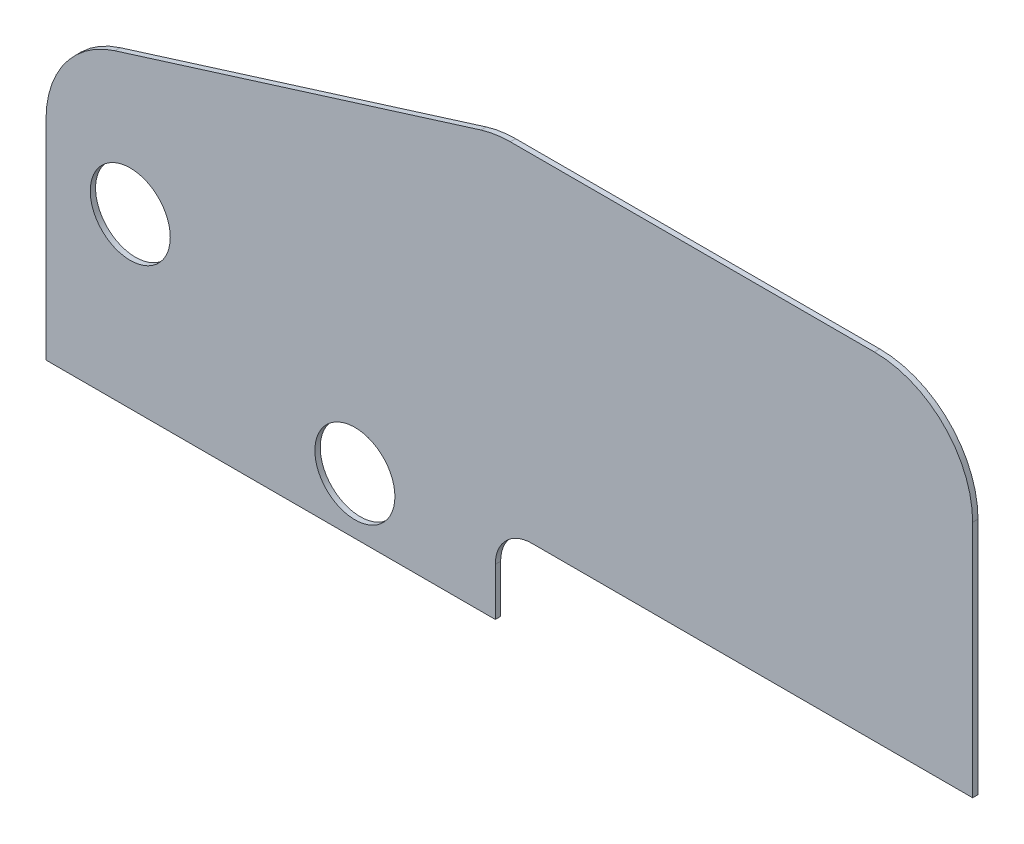
from build123d import *

# Parameters (mm, degrees)
RESSALTO_EXTRUS_O1_DEPTH = 1.9
ESBO_O2_R                = 14.25
CORTE_EXTRUS_O1_DEPTH    = 1.9
FILETE1_R                = 13
FILETE2_R                = 35


with BuildPart() as part:
    # Esboço1 → Ressalto-extrusão1 (new body)
    with BuildSketch(Plane.XY):
        Polygon((-160, 70), (0, 120), (170, 120), (170, 0), (0, 0), (0, -30), (-160, -30), align=None)
    extrude(amount=RESSALTO_EXTRUS_O1_DEPTH)

    # Esboço2 → Corte-extrusão1 (cut)
    with BuildSketch(Plane.XY.offset(1.9)):
        with Locations((-50, -10)):
            Circle(ESBO_O2_R)
        with Locations((-130, 30)):
            Circle(ESBO_O2_R)
    extrude(amount=-CORTE_EXTRUS_O1_DEPTH, mode=Mode.SUBTRACT)

    # Filete1
    filete1_edges = [part.edges().sort_by_distance(p)[0] for p in [
        (0, 0, 0.95),
    ]]
    fillet(filete1_edges, radius=FILETE1_R)

    # Filete2
    filete2_edges = [part.edges().sort_by_distance(p)[0] for p in [
        (-160, 70, 0.95),
        (0, 120, 0.95),
        (170, 120, 0.95),
    ]]
    fillet(filete2_edges, radius=FILETE2_R)


solid = part.part
